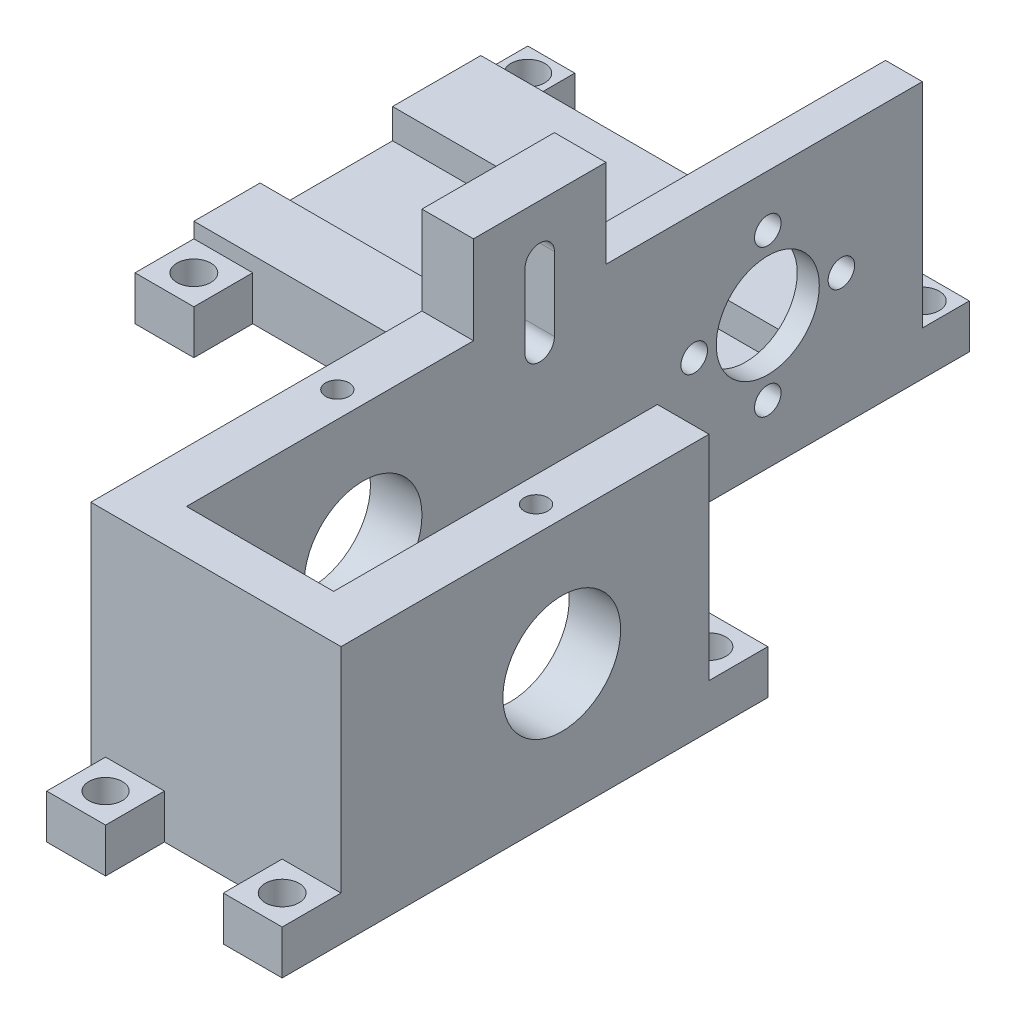
from build123d import *

# Parameters (mm, degrees)
BOSS_EXTRU_1_DEPTH       = 47
ESQUISSE3_R              = 2
ENL_V_MAT_EXTRU_2_DEPTH  = 50
ESQUISSE4_R              = 1.8
ESQUISSE4_R_2            = 7
ENL_V_MAT_EXTRU_3_DEPTH  = 5
BOSS_EXTRU_2_DEPTH       = 60
ESQUISSE11_W             = 8
ESQUISSE11_H             = 8
ESQUISSE11_R             = 2.3
ESQUISSE11_R_2           = 2.268048231
ESQUISSE11_W_2           = 6.384615385
ESQUISSE11_H_2           = 6.384615385
BOSS_EXTRU_6_DEPTH       = 6
ESQUISSE12_W             = 43
ESQUISSE12_H             = 12
ESQUISSE12_W_2           = 45
ENL_V_MAT_EXTRU_5_DEPTH  = 50
ESQUISSE13_W             = 5
ESQUISSE13_H             = 12
ENL_V_MAT_EXTRU_6_DEPTH  = 20
ESQUISSE25_R             = 13.4
ENL_V_MAT_EXTRU_8_DEPTH  = 2
ESQUISSE26_R             = 1.6
ENL_V_MAT_EXTRU_9_DEPTH  = 10
BOSS_EXTRU_7_DEPTH       = 2
ESQUISSE2_R              = 8
ENL_V_MAT_EXTRU_10_DEPTH = 60
ESQUISSE30_R             = 1.6
ENL_V_MAT_EXTRU_18_DEPTH = 10


with BuildPart() as part:
    # Esquisse1 → Boss.-Extru.1 (new body)
    with BuildSketch(Plane(origin=(0, 0, 0), x_dir=(1, 0, 0), z_dir=(0, 1, 0))):
        Polygon((-15, 0), (17, 0), (17, 50), (10, 50), (10, 6), (-10, 6), (-10, 106), (-15, 106), align=None)
    extrude(amount=BOSS_EXTRU_1_DEPTH)

    # Esquisse3 → Enlèv. mat.-Extru.2 (cut)
    with BuildSketch(Plane.ZY.offset(15)):
        with BuildLine():
            Line((-52, 30), (-52, 40))
            ThreePointArc((-52, 40), (-54, 38), (-56, 40))
            Line((-56, 40), (-56, 30))
            ThreePointArc((-56, 30), (-54, 32), (-52, 30))
        make_face()
        with Locations((-54, 40)):
            Circle(ESQUISSE3_R)
        with Locations((-54, 30)):
            Circle(ESQUISSE3_R)
    extrude(amount=-ENL_V_MAT_EXTRU_2_DEPTH, mode=Mode.SUBTRACT)

    # Esquisse4 → Enlèv. mat.-Extru.3 (cut)
    with BuildSketch(Plane(origin=(-10, 0, 0), x_dir=(0, 0, -1), z_dir=(1, 0, 0))):
        with Locations((85, 8)):
            Circle(ESQUISSE4_R)
        with Locations((95, 18)):
            Circle(ESQUISSE4_R)
        with Locations((75, 18)):
            Circle(ESQUISSE4_R)
        with Locations((85, 28)):
            Circle(ESQUISSE4_R)
        with Locations((85, 18)):
            Circle(ESQUISSE4_R_2)
    extrude(amount=-ENL_V_MAT_EXTRU_3_DEPTH, mode=Mode.SUBTRACT)

    # Esquisse4<4> → Boss.-Extru.2 (add)
    with BuildSketch(Plane(origin=(-10, 0, 0), x_dir=(0, 0, -1), z_dir=(1, 0, 0))):
        Polygon((94, 0), (106, 0), (106, 8.072261083), (94, 8.072261083), (94, 4.036130542), align=None)
        Polygon((67, 0), (76, 0), (76, 4), (76, 8.072261083), (67, 8.072261083), align=None)
        Polygon((76, 0), (94, 0), (94, 4.036130542), (76, 4), align=None)
    extrude(amount=-BOSS_EXTRU_2_DEPTH)

    # Esquisse11 → Boss.-Extru.6 (add)
    # profile 1 of 6: a face of its own
    with BuildSketch(Plane.XZ):
        with Locations((13, 4)):
            Rectangle(ESQUISSE11_W, ESQUISSE11_H)
        with Locations(Location((13, 4, 0), (0, 0, 270))):
            Circle(ESQUISSE11_R, mode=Mode.SUBTRACT)
    # profile 2 of 6: a face of its own
    with BuildSketch(Plane.XZ):
        Polygon((17, -58), (17, -50), (10, -50), (10, -46), (9, -46), (9, -58), align=None)
        with Locations(Location((13, -54, 0), (0, 0, 270))):
            Circle(ESQUISSE11_R, mode=Mode.SUBTRACT)
    # profile 3 of 6: a face of its own
    with BuildSketch(Plane.XZ):
        with Locations((-11, 4)):
            Rectangle(ESQUISSE11_W, ESQUISSE11_H)
        with Locations(Location((-11, 4, 0), (0, 0, 270))):
            Circle(ESQUISSE11_R_2, mode=Mode.SUBTRACT)
    # profile 4 of 6: a face of its own
    with BuildSketch(Plane.XZ):
        with Locations((-66, -63)):
            Rectangle(ESQUISSE11_W, ESQUISSE11_H)
        with Locations(Location((-66, -63, 0), (0, 0, 270))):
            Circle(ESQUISSE11_R, mode=Mode.SUBTRACT)
    # profile 5 of 6: a face of its own
    with BuildSketch(Plane.XZ):
        with Locations((-13.192307693, -109.192307693)):
            Rectangle(ESQUISSE11_W_2, ESQUISSE11_H_2)
        with Locations(Location((-13.192307692, -109.192307692, 0), (0, 0, 270))):
            Circle(ESQUISSE11_R, mode=Mode.SUBTRACT)
    # profile 6 of 6: a face of its own
    with BuildSketch(Plane.XZ):
        with Locations((-66.807692308, -109.192307693)):
            Rectangle(ESQUISSE11_W_2, ESQUISSE11_H_2)
        with Locations(Location((-66.807692308, -109.192307692, 0), (0, 0, 270))):
            Circle(ESQUISSE11_R, mode=Mode.SUBTRACT)
    extrude(amount=-BOSS_EXTRU_6_DEPTH)

    # Esquisse12 → Enlèv. mat.-Extru.5 (cut)
    with BuildSketch(Plane.ZY.offset(15)):
        with Locations((-84.5, 41)):
            Rectangle(ESQUISSE12_W, ESQUISSE12_H)
        with Locations((-22.5, 41)):
            Rectangle(ESQUISSE12_W_2, ESQUISSE12_H)
    extrude(amount=-ENL_V_MAT_EXTRU_5_DEPTH, mode=Mode.SUBTRACT)

    # Esquisse13 → Enlèv. mat.-Extru.6 (cut)
    with BuildSketch(Plane(origin=(17, 0, 0), x_dir=(0, 0, -1), z_dir=(1, 0, 0))):
        with Locations((47.5, 41)):
            Rectangle(ESQUISSE13_W, ESQUISSE13_H)
    extrude(amount=-ENL_V_MAT_EXTRU_6_DEPTH, mode=Mode.SUBTRACT)

    # Esquisse25 → Enlèv. mat.-Extru.8 (cut)
    with BuildSketch(Plane.ZY.offset(15)):
        with Locations((-85, 18)):
            Circle(ESQUISSE25_R)
    extrude(amount=-ENL_V_MAT_EXTRU_8_DEPTH, mode=Mode.SUBTRACT)

    # Esquisse26 → Enlèv. mat.-Extru.9 (cut)
    with BuildSketch(Plane(origin=(0, 35, 0), x_dir=(1, 0, 0), z_dir=(0, 1, 0))):
        with Locations(Location((13.5, 30, 0), (0, 0, 270))):
            Circle(ESQUISSE26_R)
    extrude(amount=-ENL_V_MAT_EXTRU_9_DEPTH, mode=Mode.SUBTRACT)

    # Esquisse27 → Boss.-Extru.7 (add)
    with BuildSketch(Plane.ZY.offset(15)):
        Polygon((0, 35), (0, 0), (-63, 0), (-63, 47), (-45, 47), (-45, 35), align=None)
    extrude(amount=BOSS_EXTRU_7_DEPTH)

    # Esquisse2 → Enlèv. mat.-Extru.10 (cut)
    with BuildSketch(Plane(origin=(17, 0, 0), x_dir=(0, 0, -1), z_dir=(1, 0, 0))):
        with Locations((30, 18)):
            Circle(ESQUISSE2_R)
    extrude(amount=-ENL_V_MAT_EXTRU_10_DEPTH, mode=Mode.SUBTRACT)

    # Esquisse30 → Enlèv. mat.-Extru.18 (cut)
    with BuildSketch(Plane(origin=(0, 35, 0), x_dir=(1, 0, 0), z_dir=(0, 1, 0))):
        with Locations(Location((-13.5, 30, 0), (0, 0, 270))):
            Circle(ESQUISSE30_R)
    extrude(amount=-ENL_V_MAT_EXTRU_18_DEPTH, mode=Mode.SUBTRACT)


solid = part.part
